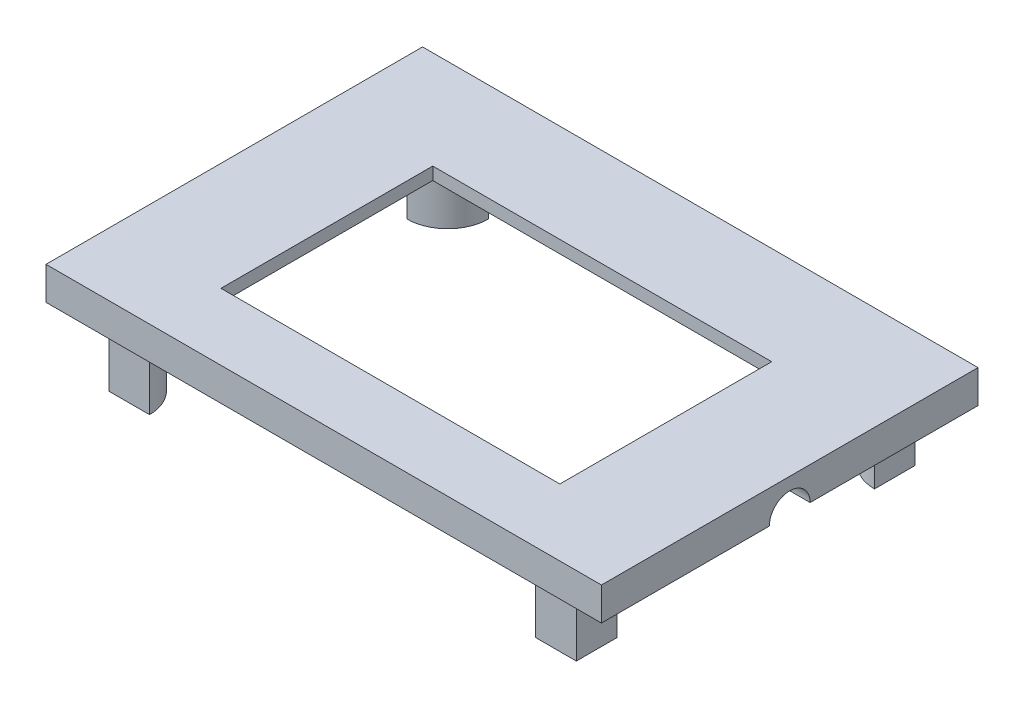
from build123d import *

# Parameters (mm, degrees)
CROQUIS1_W              = 70.8
CROQUIS1_H              = 48
CROQUIS1_W_2            = 60.4
CROQUIS1_H_2            = 44
CROQUIS1_W_3            = 59.6
CROQUIS1_H_3            = 43.2
CROQUIS1_W_4            = 43.2
CROQUIS1_H_4            = 27
SALIENTE_EXTRUIR1_DEPTH = 1.6
SALIENTE_EXTRUIR2_DEPTH = 10.8
CROQUIS1_5_W            = 70.8
CROQUIS1_5_H            = 48
CROQUIS1_5_W_2          = 60.4
CROQUIS1_5_H_2          = 44
CROQUIS1_5_W_3          = 59.6
CROQUIS1_5_H_3          = 43.2
SALIENTE_EXTRUIR3_DEPTH = 2.6
CORTAR_EXTRUIR1_REACH   = 77.533


with BuildPart() as part:
    # Croquis1 → Saliente-Extruir1 (new body)
    # profile 1 of 7: a face of its own
    with BuildSketch(Plane(origin=(0, 0, 0), x_dir=(1, 0, 0), z_dir=(0, 1, 0))):
        Rectangle(CROQUIS1_W, CROQUIS1_H)
        Rectangle(CROQUIS1_W_2, CROQUIS1_H_2, mode=Mode.SUBTRACT)
    # profile 2 of 7: a face of its own
    with BuildSketch(Plane(origin=(0, 0, 0), x_dir=(1, 0, 0), z_dir=(0, 1, 0))):
        Rectangle(CROQUIS1_W_2, CROQUIS1_H_2)
        Rectangle(CROQUIS1_W_3, CROQUIS1_H_3, mode=Mode.SUBTRACT)
    # profile 3 of 7: a face of its own
    with BuildSketch(Plane(origin=(0, 0, 0), x_dir=(1, 0, 0), z_dir=(0, 1, 0))):
        with BuildLine():
            ThreePointArc((-29.8, -16.4), (-26.123044738, -17.923044738), (-24.6, -21.6))
            Line((-24.6, -21.6), (24.6, -21.6))
            ThreePointArc((24.6, -21.6), (26.123044738, -17.923044738), (29.8, -16.4))
            Line((29.8, -16.4), (29.8, 16.4))
            ThreePointArc((29.8, 16.4), (26.123044738, 17.923044738), (24.6, 21.6))
            Line((24.6, 21.6), (-24.6, 21.6))
            ThreePointArc((-24.6, 21.6), (-26.123044738, 17.923044738), (-29.8, 16.4))
            Line((-29.8, 16.4), (-29.8, -16.4))
        make_face()
        with Locations((0, -2)):
            Rectangle(CROQUIS1_W_4, CROQUIS1_H_4, mode=Mode.SUBTRACT)
    # profile 4 of 7: a face of its own
    with BuildSketch(Plane(origin=(0, 0, 0), x_dir=(1, 0, 0), z_dir=(0, 1, 0))):
        with BuildLine():
            ThreePointArc((29.8, -16.4), (26.123044738, -17.923044738), (24.6, -21.6))
            Line((24.6, -21.6), (29.8, -21.6))
            Line((29.8, -21.6), (29.8, -16.4))
        make_face()
    # profile 5 of 7: a face of its own
    with BuildSketch(Plane(origin=(0, 0, 0), x_dir=(1, 0, 0), z_dir=(0, 1, 0))):
        with BuildLine():
            ThreePointArc((24.6, 21.6), (26.123044738, 17.923044738), (29.8, 16.4))
            Line((29.8, 16.4), (29.8, 21.6))
            Line((29.8, 21.6), (24.6, 21.6))
        make_face()
    # profile 6 of 7: a face of its own
    with BuildSketch(Plane(origin=(0, 0, 0), x_dir=(1, 0, 0), z_dir=(0, 1, 0))):
        with BuildLine():
            Line((-29.8, 21.6), (-29.8, 16.4))
            ThreePointArc((-29.8, 16.4), (-26.123044738, 17.923044738), (-24.6, 21.6))
            Line((-24.6, 21.6), (-29.8, 21.6))
        make_face()
    # profile 7 of 7: a face of its own
    with BuildSketch(Plane(origin=(0, 0, 0), x_dir=(1, 0, 0), z_dir=(0, 1, 0))):
        with BuildLine():
            Line((-29.8, -16.4), (-29.8, -21.6))
            Line((-29.8, -21.6), (-24.6, -21.6))
            ThreePointArc((-24.6, -21.6), (-26.123044738, -17.923044738), (-29.8, -16.4))
        make_face()
    extrude(amount=SALIENTE_EXTRUIR1_DEPTH)

    # Croquis1<4> → Saliente-Extruir2 (add)
    with BuildSketch(Plane(origin=(0, 0, 0), x_dir=(1, 0, 0), z_dir=(0, 1, 0))):
        with BuildLine():
            Line((-29.8, -16.4), (-29.8, -21.6))
            Line((-29.8, -21.6), (-24.6, -21.6))
            ThreePointArc((-24.6, -21.6), (-26.123044738, -17.923044738), (-29.8, -16.4))
        make_face()
        with BuildLine():
            Line((-29.8, 21.6), (-29.8, 16.4))
            ThreePointArc((-29.8, 16.4), (-26.123044738, 17.923044738), (-24.6, 21.6))
            Line((-24.6, 21.6), (-29.8, 21.6))
        make_face()
        with BuildLine():
            ThreePointArc((24.6, 21.6), (26.123044738, 17.923044738), (29.8, 16.4))
            Line((29.8, 16.4), (29.8, 21.6))
            Line((29.8, 21.6), (24.6, 21.6))
        make_face()
        with BuildLine():
            ThreePointArc((29.8, -16.4), (26.123044738, -17.923044738), (24.6, -21.6))
            Line((24.6, -21.6), (29.8, -21.6))
            Line((29.8, -21.6), (29.8, -16.4))
        make_face()
    extrude(amount=-SALIENTE_EXTRUIR2_DEPTH)

    # Croquis1<5> → Saliente-Extruir3 (add)
    # profile 1 of 2: a face of its own
    with BuildSketch(Plane(origin=(0, 0, 0), x_dir=(1, 0, 0), z_dir=(0, 1, 0))):
        Rectangle(CROQUIS1_5_W, CROQUIS1_5_H)
        Rectangle(CROQUIS1_5_W_2, CROQUIS1_5_H_2, mode=Mode.SUBTRACT)
    # profile 2 of 2: a face of its own
    with BuildSketch(Plane(origin=(0, 0, 0), x_dir=(1, 0, 0), z_dir=(0, 1, 0))):
        Rectangle(CROQUIS1_5_W_2, CROQUIS1_5_H_2)
        Rectangle(CROQUIS1_5_W_3, CROQUIS1_5_H_3, mode=Mode.SUBTRACT)
    extrude(amount=-SALIENTE_EXTRUIR3_DEPTH)

    # Cortar-Extruir1: up to this face of the body (flat: up to its plane)
    cortar_extruir1_end = Plane(part.part.faces().sort_by_distance((-35.4, -0.5, 0))[0])
    # Croquis2 → Cortar-Extruir1 (cut, up to the picked face)
    with BuildSketch(Plane(origin=(35.4, 0, 0), x_dir=(0, 0, -1), z_dir=(1, 0, 0)), mode=Mode.PRIVATE) as cortar_extruir1_sk1:
        with BuildLine():
            Line((-2.6, -2.6), (2.6, -2.6))
            ThreePointArc((2.6, -2.6), (0, 0), (-2.6, -2.6))
        make_face()
    cortar_extruir1_tool1 = split(extrude(cortar_extruir1_sk1.sketch, amount=-CORTAR_EXTRUIR1_REACH, mode=Mode.PRIVATE), bisect_by=cortar_extruir1_end, keep=Keep.BOTH, mode=Mode.PRIVATE)
    add(cortar_extruir1_tool1.solids().sort_by(Axis((35.4, -1.496526, 0), (-1, 0, 0)))[0], mode=Mode.SUBTRACT)


solid = part.part
